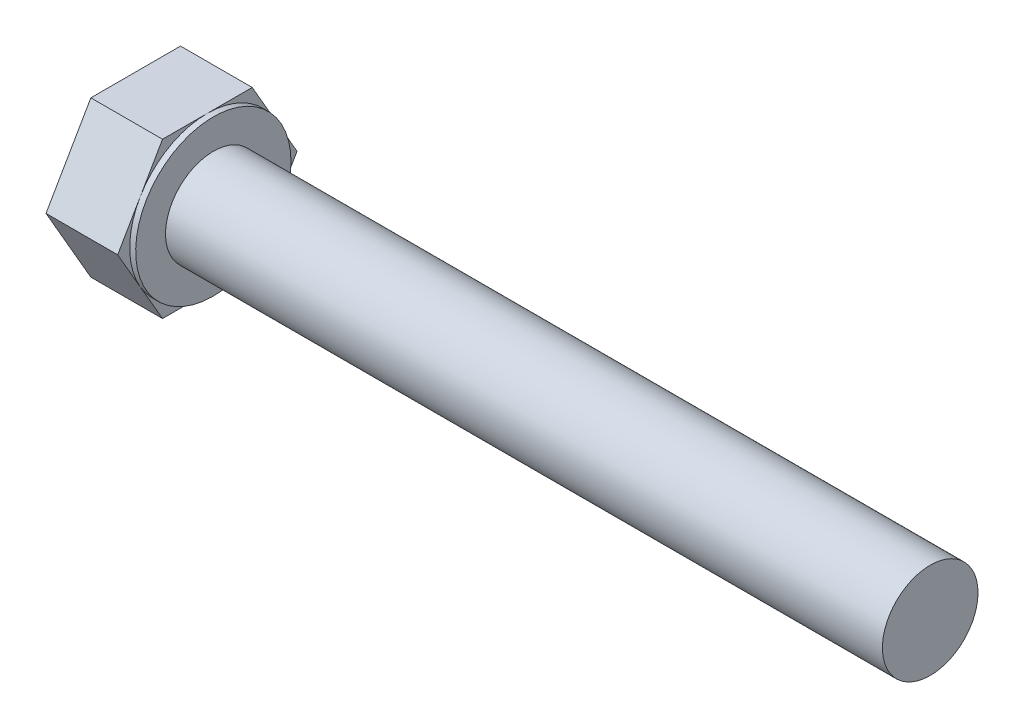
from build123d import *

# Parameters (mm, degrees)
BOSS_EXTRUDE1_DEPTH = 6
SKETCH2_R           = 6.5
BOSS_EXTRUDE2_DEPTH = 0.5
SKETCH3_R           = 4
BOSS_EXTRUDE3_DEPTH = 60


with BuildPart() as part:
    # Sketch1 → Boss-Extrude1 (new body)
    with BuildSketch(Plane(origin=(0, 0, 0), x_dir=(0, 0, -1), z_dir=(1, 0, 0))):
        Polygon((-7.505553499, 0), (-3.75277675, -6.5), (3.75277675, -6.5), (7.505553499, 0), (3.75277675, 6.5), (-3.75277675, 6.5), align=None)
    extrude(amount=-BOSS_EXTRUDE1_DEPTH)

    # Sketch2 → Boss-Extrude2 (add)
    with BuildSketch(Plane(origin=(0, 0, 0), x_dir=(0, 0, -1), z_dir=(1, 0, 0))):
        with Locations(Location((0, 0, 0), (0, 0, 150))):
            Circle(SKETCH2_R)
    extrude(amount=BOSS_EXTRUDE2_DEPTH)

    # Sketch3 → Boss-Extrude3 (add)
    with BuildSketch(Plane(origin=(0.5, 0, 0), x_dir=(0, 0, -1), z_dir=(1, 0, 0))):
        Circle(SKETCH3_R)
    extrude(amount=BOSS_EXTRUDE3_DEPTH)


solid = part.part
